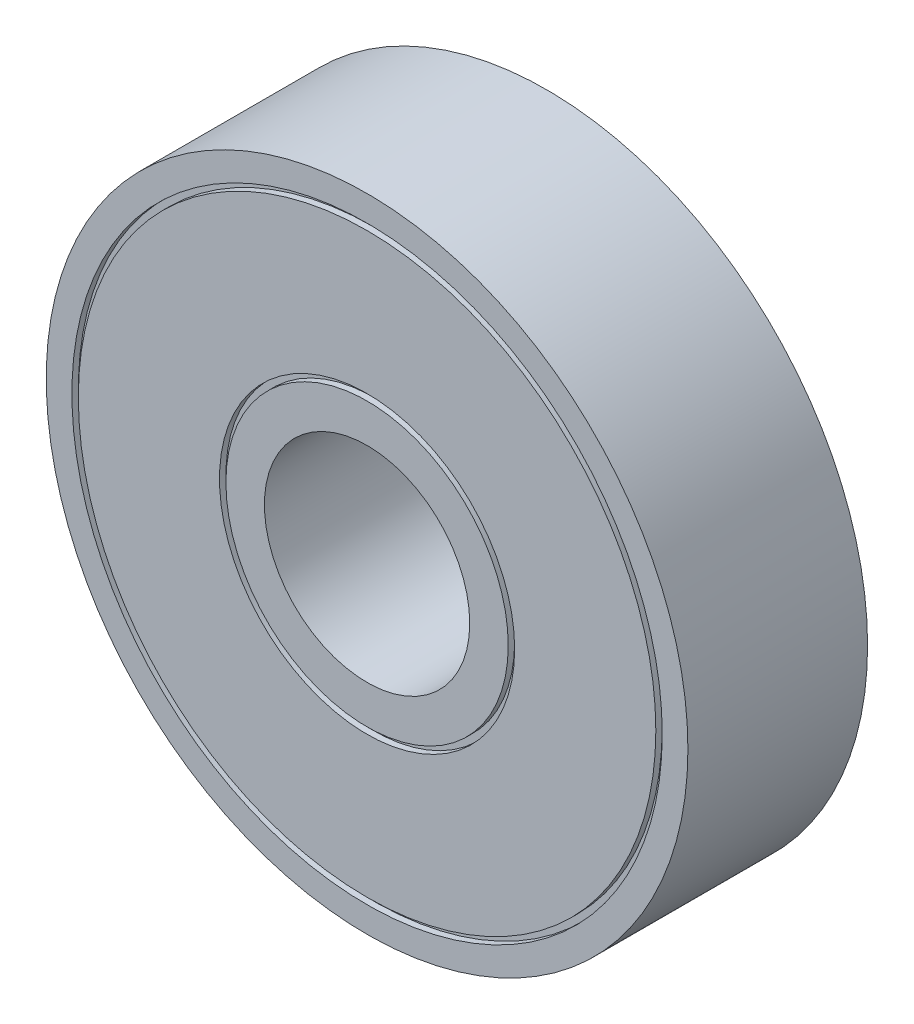
from build123d import *

# Parameters (mm, degrees)
ESBO_O1_R                = 12.5
ESBO_O1_R_2              = 4
RESSALTO_EXTRUS_O1_DEPTH = 3.5
ESBO_O2_R                = 11.5
ESBO_O2_R_2              = 11.25
ESBO_O2_R_3              = 5.75
ESBO_O2_R_4              = 5.5
CORTE_EXTRUS_O1_DEPTH    = 0.25


with BuildPart() as part:
    # Esboço1 → Ressalto-extrusão1 (new, symmetric)
    with BuildSketch(Plane.XY):
        Circle(ESBO_O1_R)
        Circle(ESBO_O1_R_2, mode=Mode.SUBTRACT)
    extrude(amount=RESSALTO_EXTRUS_O1_DEPTH, both=True)

    # Esboço2 → Corte-extrusão1 (cut)
    # profile 1 of 2: a face of its own
    with BuildSketch(Plane.XY.offset(3.5)):
        Circle(ESBO_O2_R)
        Circle(ESBO_O2_R_2, mode=Mode.SUBTRACT)
    # profile 2 of 2: a face of its own
    with BuildSketch(Plane.XY.offset(3.5)):
        Circle(ESBO_O2_R_3)
        Circle(ESBO_O2_R_4, mode=Mode.SUBTRACT)
    corte_extrus_o1 = extrude(amount=-CORTE_EXTRUS_O1_DEPTH, mode=Mode.SUBTRACT)

    # Espelhar1: Corte-extrusão1 across plane
    add(corte_extrus_o1.mirror(Plane.XY), mode=Mode.SUBTRACT)


solid = part.part
